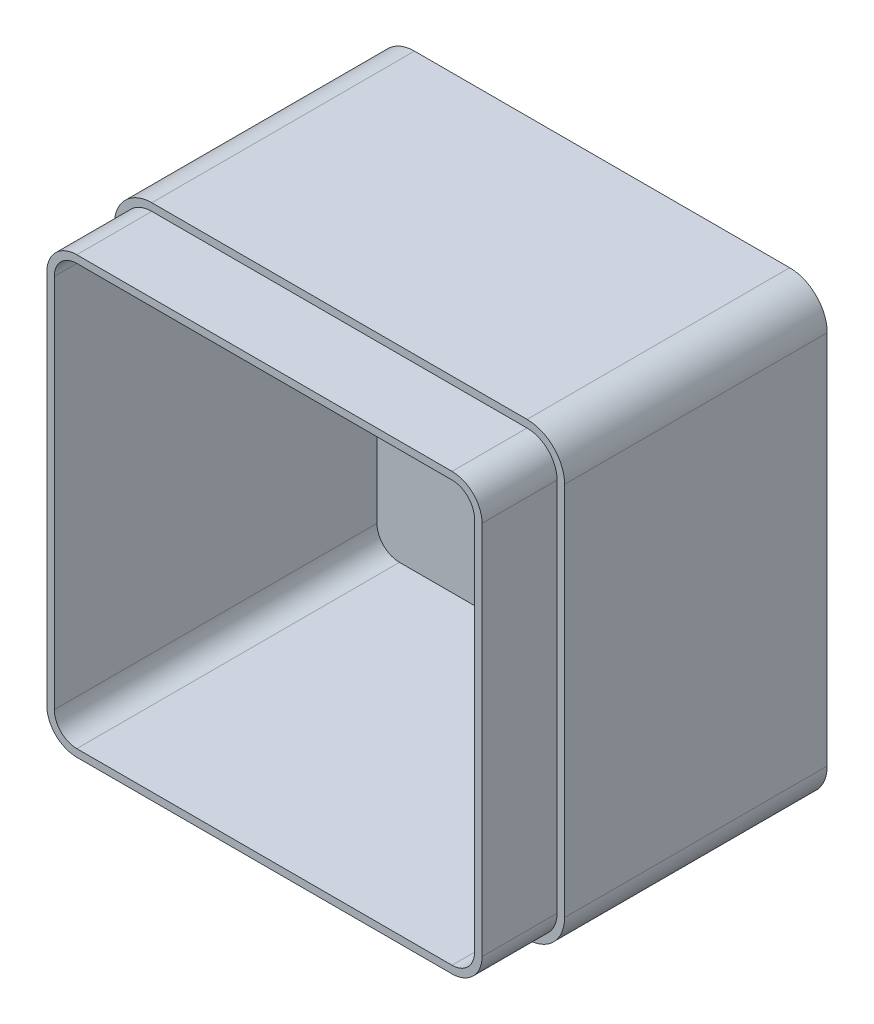
from build123d import *

# Parameters (mm, degrees)
SKETCH1_W           = 120
SKETCH1_H           = 120
BOSS_EXTRUDE1_DEPTH = 90
FILLET1_R           = 10
SHELL1_T            = -4
CUT_EXTRUDE1_DEPTH  = 20


with BuildPart() as part:
    # Sketch1 → Boss-Extrude1 (new body)
    with BuildSketch(Plane.XY):
        with Locations((60, 60)):
            Rectangle(SKETCH1_W, SKETCH1_H)
    extrude(amount=BOSS_EXTRUDE1_DEPTH)

    # Fillet1
    fillet1_edges = [part.edges().sort_by_distance(p)[0] for p in [
        (0, 120, 45),
        (120, 120, 45),
        (120, 0, 45),
        (0, 0, 45),
    ]]
    fillet(fillet1_edges, radius=FILLET1_R)

    # Shell1
    shell1_openings = [part.faces().sort_by_distance(p)[0] for p in [
        (60, 60, 90),
    ]]
    offset(amount=SHELL1_T, openings=shell1_openings, kind=Kind.INTERSECTION)

    # Sketch2 → Cut-Extrude1 (cut)
    with BuildSketch(Plane.XY.offset(90)):
        with BuildLine():
            Line((110, 120), (10, 120))
            ThreePointArc((10, 120), (2.928932188, 117.071067812), (0, 110))
            Line((0, 110), (0, 10))
            ThreePointArc((0, 10), (2.928932188, 2.928932188), (10, 0))
            Line((10, 0), (110, 0))
            ThreePointArc((110, 0), (117.071067812, 2.928932188), (120, 10))
            Line((120, 10), (120, 110))
            ThreePointArc((120, 110), (117.071067812, 117.071067812), (110, 120))
        make_face()
        with BuildLine():
            Line((110, 118), (10, 118))
            ThreePointArc((10, 118), (4.343145751, 115.656854249), (2, 110))
            Line((2, 110), (2, 10))
            ThreePointArc((2, 10), (4.343145751, 4.343145751), (10, 2))
            Line((10, 2), (110, 2))
            ThreePointArc((110, 2), (115.656854249, 4.343145751), (118, 10))
            Line((118, 10), (118, 110))
            ThreePointArc((118, 110), (115.656854249, 115.656854249), (110, 118))
        make_face(mode=Mode.SUBTRACT)
    extrude(amount=-CUT_EXTRUDE1_DEPTH, mode=Mode.SUBTRACT)


solid = part.part
